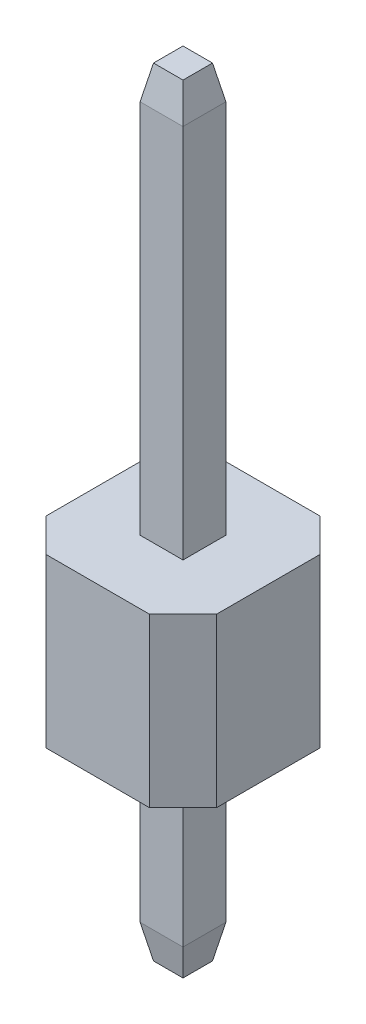
from build123d import *
from OCP.BRepFilletAPI import BRepFilletAPI_MakeChamfer

# Parameters (mm, degrees)
EXTRUDE_1_DEPTH      = 8.6
EXTRUDE_1_DEPTH_BACK = 3
SKETCH_1_W           = 0.64
SKETCH_1_H           = 0.64
CHAMFER_1_SIZE       = 0.5
CHAMFER_1_SIZE2      = 0.1
CHAMFER_2_SIZE       = 0.1
CHAMFER_2_SIZE2      = 0.5
EXTRUDE_2_DEPTH      = 2.5


with BuildPart() as part:
    # Эскиз1 → Бобышка-Вытянуть1 (new, two sides: drawn at the far end of the back side and taken through both)
    with BuildSketch(Plane(origin=(0, 0, 0), x_dir=(1, 0, 0), z_dir=(0, 1, 0)).offset(-EXTRUDE_1_DEPTH_BACK)):
        Rectangle(SKETCH_1_W, SKETCH_1_H)
    extrude(amount=EXTRUDE_1_DEPTH + EXTRUDE_1_DEPTH_BACK)

    # Фаска1: one chamfer whose edges measure the first distance from different faces: ONE call of the kernel's chamfer builder (chamfer() names one face for all edges)
    chamfer_1_edges_1 = [part.edges().sort_by_distance(p)[0] for p in [
        (-0.32, 8.6, 0),
    ]]
    chamfer_1_side_1 = [part.faces().sort_by_distance(p)[0] for p in [
        (-0.32, 2.8, 0),
    ]]
    chamfer_1_edges_2 = [part.edges().sort_by_distance(p)[0] for p in [
        (0, 8.6, 0.32),
    ]]
    chamfer_1_side_2 = [part.faces().sort_by_distance(p)[0] for p in [
        (0, 2.8, 0.32),
    ]]
    chamfer_1_edges_3 = [part.edges().sort_by_distance(p)[0] for p in [
        (0.32, 8.6, 0),
    ]]
    chamfer_1_side_3 = [part.faces().sort_by_distance(p)[0] for p in [
        (0.32, 2.8, 0),
    ]]
    chamfer_1_edges_4 = [part.edges().sort_by_distance(p)[0] for p in [
        (0, 8.6, -0.32),
    ]]
    chamfer_1_side_4 = [part.faces().sort_by_distance(p)[0] for p in [
        (0, 2.8, -0.32),
    ]]
    chamfer_1 = BRepFilletAPI_MakeChamfer(part.part.solid().wrapped)
    for e in chamfer_1_edges_1:
        chamfer_1.Add(CHAMFER_1_SIZE, CHAMFER_1_SIZE2, e.wrapped, chamfer_1_side_1[0].wrapped)  # the first distance lies on this face
    for e in chamfer_1_edges_2:
        chamfer_1.Add(CHAMFER_1_SIZE, CHAMFER_1_SIZE2, e.wrapped, chamfer_1_side_2[0].wrapped)  # the first distance lies on this face
    for e in chamfer_1_edges_3:
        chamfer_1.Add(CHAMFER_1_SIZE, CHAMFER_1_SIZE2, e.wrapped, chamfer_1_side_3[0].wrapped)  # the first distance lies on this face
    for e in chamfer_1_edges_4:
        chamfer_1.Add(CHAMFER_1_SIZE, CHAMFER_1_SIZE2, e.wrapped, chamfer_1_side_4[0].wrapped)  # the first distance lies on this face
    add(Compound.cast(chamfer_1.Shape()), mode=Mode.REPLACE)

    # Фаска2
    chamfer_2_edges = [part.edges().sort_by_distance(p)[0] for p in [
        (0.32, -3, 0),
        (0, -3, 0.32),
        (-0.32, -3, 0),
        (0, -3, -0.32),
    ]]
    chamfer_2_side = [part.faces().sort_by_distance(p)[0] for p in [
        (0, -3, 0),
    ]]
    chamfer(chamfer_2_edges, length=CHAMFER_2_SIZE, length2=CHAMFER_2_SIZE2, reference=chamfer_2_side[0])


with BuildPart() as body_2:
    # Эскиз2 → Бобышка-Вытянуть2 (new body)
    with BuildSketch(Plane(origin=(0, 0, 0), x_dir=(1, 0, 0), z_dir=(0, 1, 0))):
        Polygon((-1.27, 0.77), (-0.77, 1.27), (0.77, 1.27), (1.27, 0.77), (1.27, -0.77), (0.77, -1.27), (-0.77, -1.27), (-1.27, -0.77), align=None)
    extrude(amount=EXTRUDE_2_DEPTH)


solid = Compound([part.part, body_2.part])
